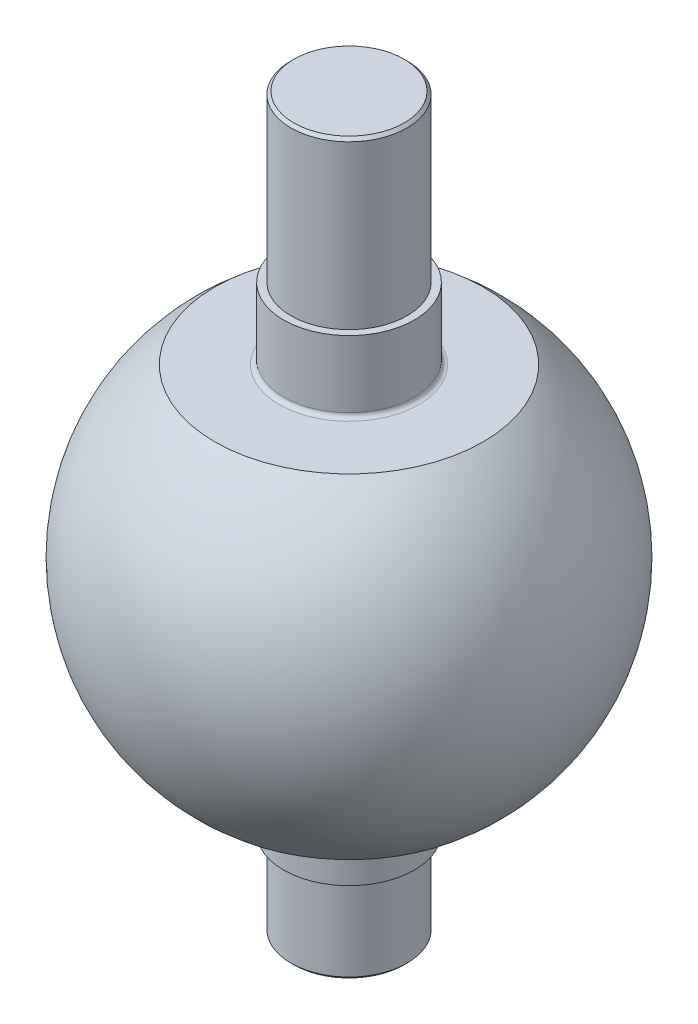
from build123d import *


with BuildPart() as part:
    # Эскиз1 → Повернуть1 (revolve)
    with BuildSketch(Plane.XY, mode=Mode.PRIVATE) as revolve_1_sk:
        with BuildLine():
            Line((-92.36476601, 115), (-48, 115))
            ThreePointArc((-48, 115), (-45.878679656, 115.878679656), (-45, 118))
            Line((-45, 118), (-45, 164))
            Line((-45, 164), (-40, 164))
            Line((-40, 164), (-40, 276))
            Line((-40, 276), (-38, 278))
            Line((-38, 278), (0, 278))
            Line((0, 278), (0, -224))
            Line((0, -224), (-38, -224))
            Line((-38, -224), (-40, -222))
            Line((-40, -222), (-40, -164))
            Line((-40, -164), (-45, -164))
            Line((-45, -164), (-45, -118))
            ThreePointArc((-45, -118), (-45.878679656, -115.878679656), (-48, -115))
            Line((-48, -115), (-92.36476601, -115))
            ThreePointArc((-92.36476601, -115), (-147.5, 0), (-92.36476601, 115))
        make_face()
    revolve(revolve_1_sk.sketch.rotate(Axis((0, 332.383276995, 0), (0, -1, 0)), 270), axis=Axis((0, 332.383276995, 0), (0, -1, 0)))


solid = part.part
